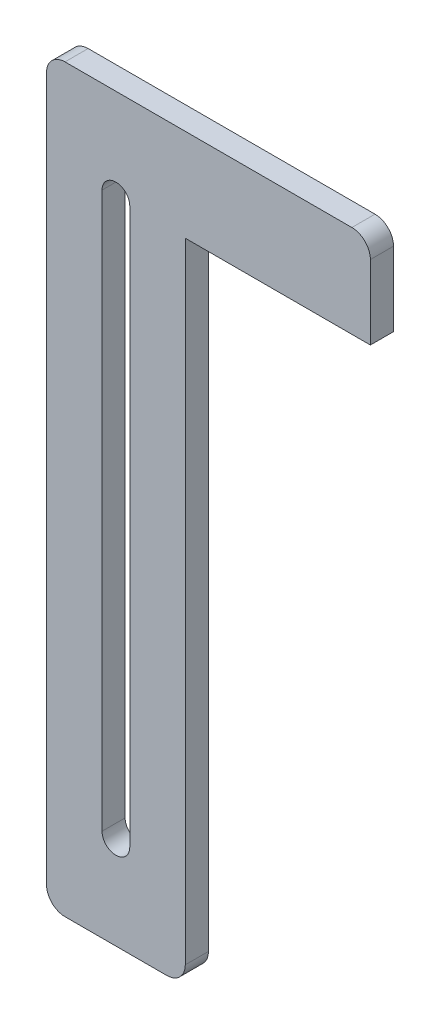
from build123d import *

# Parameters (mm, degrees)
SKETCH1_W           = 25.4
SKETCH1_H           = 12.7
BOSS_EXTRUDE1_DEPTH = 3.175
FILLET1_R           = 2.54


with BuildPart() as part:
    # Sketch1 → Boss-Extrude1 (new body)
    # profile 1 of 2: a face of its own
    with BuildSketch(Plane.XY):
        Polygon((0, 101.6), (0, 0), (19.05, 0), (19.05, 88.9), (19.05, 101.6), align=None)
        with BuildLine():
            ThreePointArc((7.62, 88.9), (9.525, 90.805), (11.43, 88.9))
            Line((11.43, 88.9), (11.43, 12.7))
            ThreePointArc((11.43, 12.7), (9.525, 10.795), (7.62, 12.7))
            Line((7.62, 12.7), (7.62, 88.9))
        make_face(mode=Mode.SUBTRACT)
    # profile 2 of 2: a face of its own
    with BuildSketch(Plane.XY):
        with Locations((31.75, 95.25)):
            Rectangle(SKETCH1_W, SKETCH1_H)
    extrude(amount=BOSS_EXTRUDE1_DEPTH)

    # Fillet1
    fillet1_edges = [part.edges().sort_by_distance(p)[0] for p in [
        (19.05, 0, 1.5875),
        (0, 0, 1.5875),
        (44.45, 101.6, 1.5875),
        (0, 101.6, 1.5875),
    ]]
    fillet(fillet1_edges, radius=FILLET1_R)


solid = part.part
